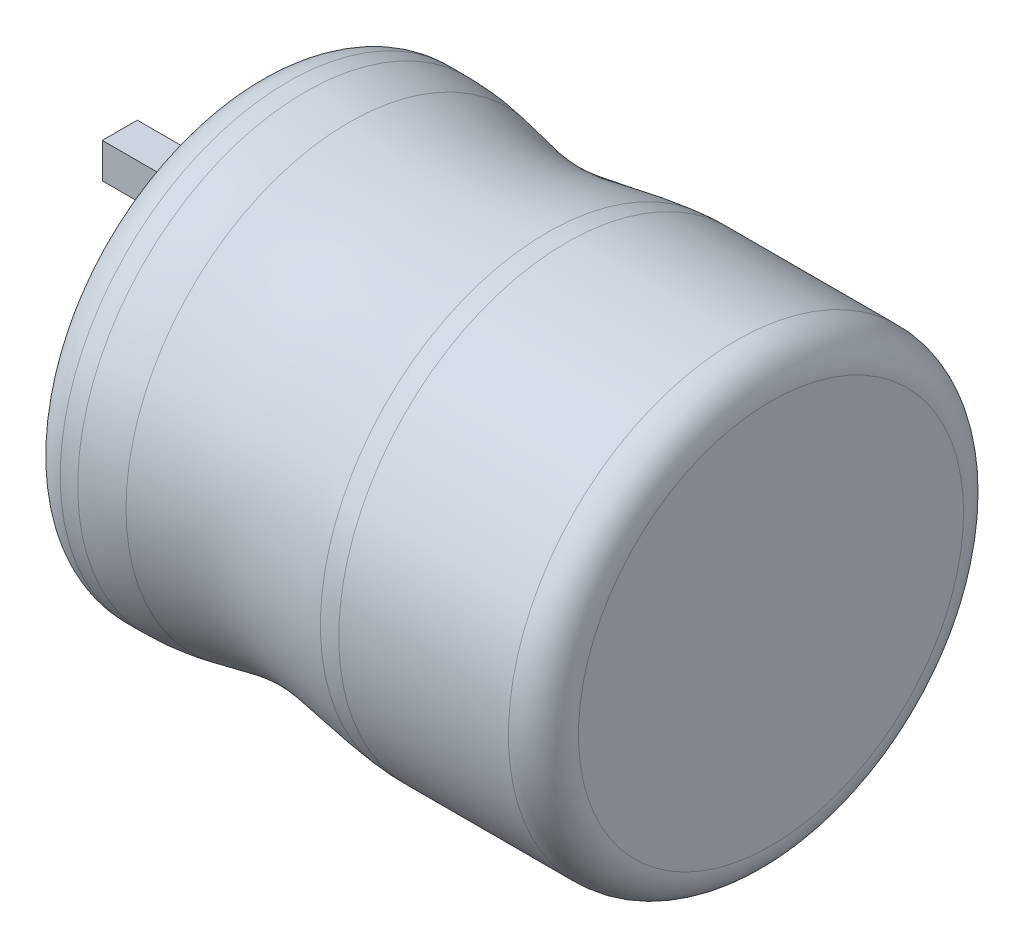
from build123d import *

# Parameters (mm, degrees)
SKICA2_W                = 0.5
SKICA2_H                = 0.5
P_IDAT_VYSUNUT_M1_DEPTH = 1.9


with BuildPart() as part:
    # Skica1 → Rotovat1 (revolve)
    with BuildSketch(Plane.XY, mode=Mode.PRIVATE) as rotovat1_sk:
        with BuildLine():
            Line((0, 0), (0, 2.75))
            ThreePointArc((0, 2.75), (0.146446609, 3.103553391), (0.5, 3.25))
            Line((0.5, 3.25), (0.749493844, 3.25))
            ThreePointArc((0.749493844, 3.25), (1.063131818, 3.233560159), (1.373332352, 3.184420814))
            add(Edge.make_bspline(
                [(1.373332352, 3.184420814), (1.844148672, 3.08432837), (2.637509596, 2.913100219), (3.679859415, 3.18917118), (4.202566014, 3.237341565)],
                knots=[0.049740357, 0.049740357, 0.049740357, 0.049740357, 0.292962234, 0.585924467, 0.585924467, 0.585924467, 0.585924467], degree=3))
            ThreePointArc((4.202566014, 3.237341565), (4.340070837, 3.24683372), (4.477866527, 3.25))
            Line((4.477866527, 3.25), (6.9, 3.25))
            ThreePointArc((6.9, 3.25), (7.253553391, 3.103553391), (7.4, 2.75))
            Line((7.4, 2.75), (7.4, 0))
            Line((7.4, 0), (0, 0))
        make_face()
    revolve(rotovat1_sk.sketch.rotate(Axis((7.4, 0, 0), (-1, 0, 0)), 90), axis=Axis((7.4, 0, 0), (-1, 0, 0)))

    # Skica2 → Přidat vysunutím1 (add)
    with BuildSketch(Plane.ZY):
        with Locations((0, -1.2)):
            Rectangle(SKICA2_W, SKICA2_H)
        with Locations((0, 1.2)):
            Rectangle(SKICA2_W, SKICA2_H)
    extrude(amount=P_IDAT_VYSUNUT_M1_DEPTH)


solid = part.part
